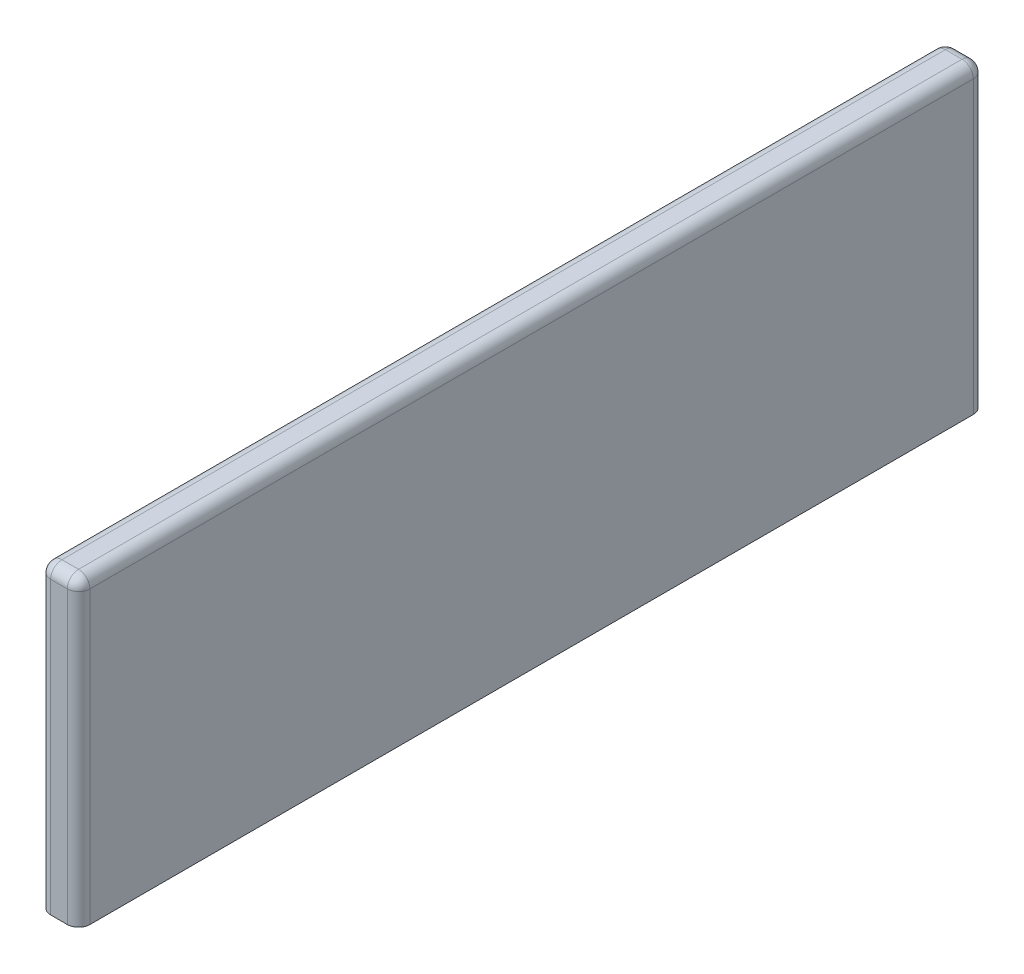
from build123d import *

# Parameters (mm, degrees)
SCHIZZO2_W                   = 2.6
SCHIZZO2_H                   = 20
ESTRUSIONE_ESTRUSIONE1_DEPTH = 60
RACCORDO1_R                  = 0.75


with BuildPart() as part:
    # Schizzo2 → Estrusione-Estrusione1 (new body)
    with BuildSketch(Plane.XY):
        with Locations((-1.3, 10)):
            Rectangle(SCHIZZO2_W, SCHIZZO2_H)
    extrude(amount=ESTRUSIONE_ESTRUSIONE1_DEPTH)

    # Raccordo1
    raccordo1_edges = [part.edges().sort_by_distance(p)[0] for p in [
        (-2.6, 10, 60),
        (0, 10, 60),
        (-2.6, 10, 0),
        (-1.3, 20, 0),
        (0, 10, 0),
        (-2.6, 20, 30),
        (0, 20, 30),
        (-1.3, 20, 60),
    ]]
    fillet(raccordo1_edges, radius=RACCORDO1_R)


solid = part.part
